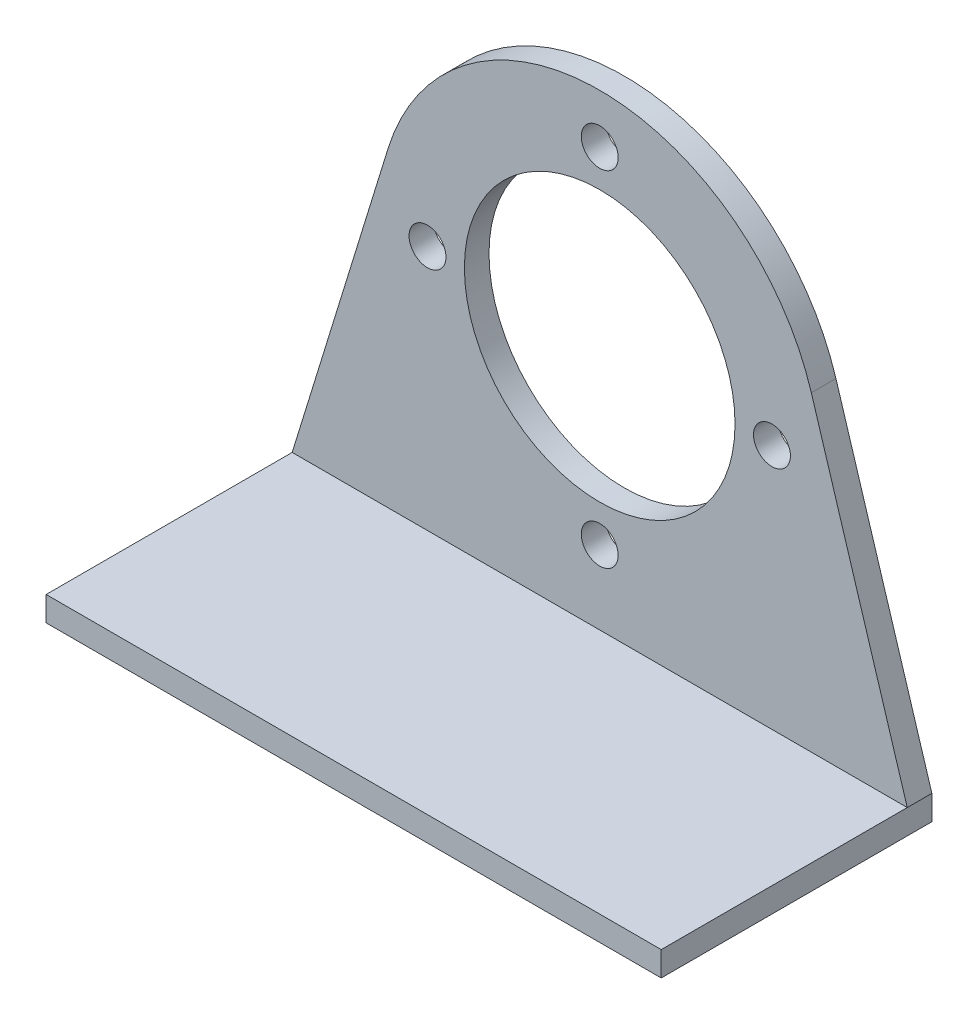
from build123d import *

# Parameters (mm, degrees)
SKETCH1_R                = 11
SKETCH1_R_2              = 1.5
BOSS_EXTRUDE1_DEPTH      = 2
BOSS_EXTRUDE2_DEPTH      = 20
BOSS_EXTRUDE2_DEPTH_BACK = 2
SKETCH2_W                = 50
SKETCH2_H                = 2


with BuildPart() as part:
    # Sketch1 → Boss-Extrude1 (new body)
    with BuildSketch(Plane.XY):
        with BuildLine():
            Line((-25, -20), (25, -20))
            Line((25, -20), (17.201468929, 5.301836161))
            ThreePointArc((17.201468929, 5.301836161), (0, 18), (-17.201468929, 5.301836161))
            Line((-17.201468929, 5.301836161), (-25, -20))
        make_face()
        Circle(SKETCH1_R, mode=Mode.SUBTRACT)
        with Locations((0, 14)):
            Circle(SKETCH1_R_2, mode=Mode.SUBTRACT)
        with Locations((14, 0)):
            Circle(SKETCH1_R_2, mode=Mode.SUBTRACT)
        with Locations((0, -14)):
            Circle(SKETCH1_R_2, mode=Mode.SUBTRACT)
        with Locations((-14, 0)):
            Circle(SKETCH1_R_2, mode=Mode.SUBTRACT)
    extrude(amount=BOSS_EXTRUDE1_DEPTH)

    # Sketch2 → Boss-Extrude2 (add, two sides: drawn at the far end of the back side and taken through both)
    with BuildSketch(Plane.XY.offset(2).offset(-BOSS_EXTRUDE2_DEPTH_BACK)):
        with Locations((0, -21)):
            Rectangle(SKETCH2_W, SKETCH2_H)
    extrude(amount=BOSS_EXTRUDE2_DEPTH + BOSS_EXTRUDE2_DEPTH_BACK)


solid = part.part
